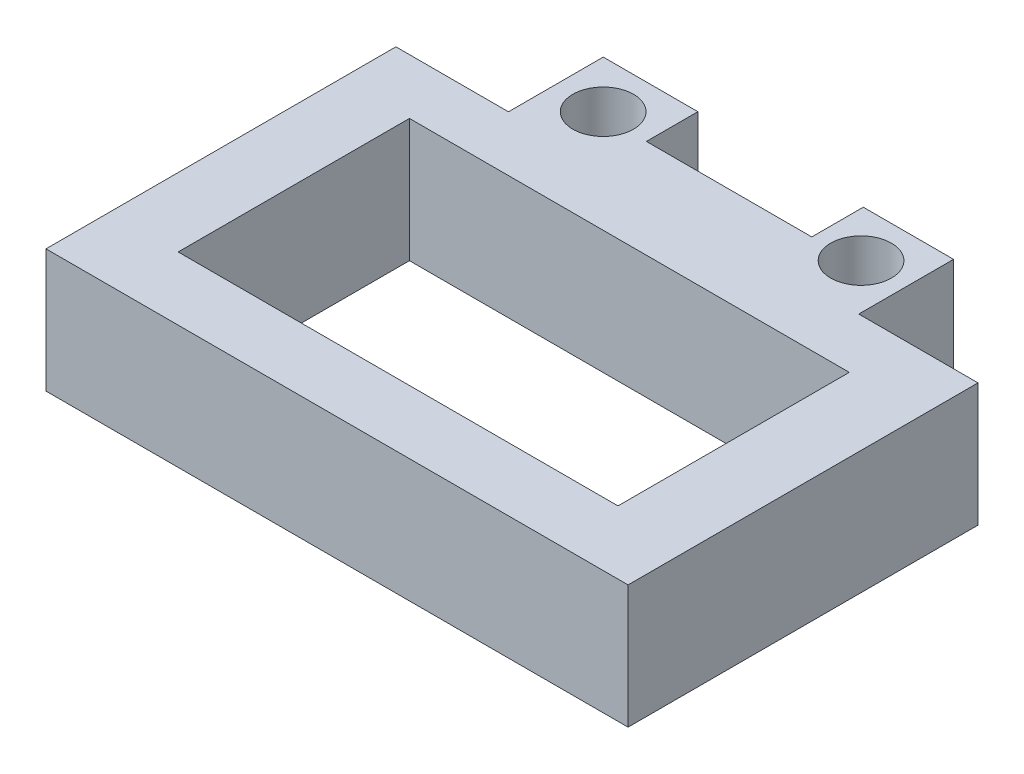
from build123d import *

# Parameters (mm, degrees)
SKETCH1_R           = 1.6
SKETCH1_W           = 30.70266837
SKETCH1_H           = 18.457088441
SKETCH1_W_2         = 23.2
SKETCH1_H_2         = 12.2
BOSS_EXTRUDE5_DEPTH = 6.5


with BuildPart() as part:
    # Sketch1 → Boss-Extrude5 (new body)
    # profile 1 of 2: a face of its own
    with BuildSketch(Plane(origin=(0, 0, 0), x_dir=(1, 0, 0), z_dir=(0, 1, 0))):
        Polygon((23.208363186, 35.61697891), (23.208363186, 32.900104101), (31.932950893, 32.900104101), (31.932950893, 35.61697891), (36.695280427, 35.61697891), (36.695280427, 30.61697891), (18.217441835, 30.61697891), (18.217441835, 35.61697891), align=None)
        with Locations(Location((20.712902511, 33.11697891, 0), (0, 0, 90))):
            Circle(SKETCH1_R, mode=Mode.SUBTRACT)
        with Locations(Location((34.31411566, 33.11697891, 0), (0, 0, 90))):
            Circle(SKETCH1_R, mode=Mode.SUBTRACT)
    # profile 2 of 2: a face of its own
    with BuildSketch(Plane(origin=(0, 0, 0), x_dir=(1, 0, 0), z_dir=(0, 1, 0))):
        with Locations((27.63237184, 21.38843469)):
            Rectangle(SKETCH1_W, SKETCH1_H)
        with Locations((27.508406256, 21.602944359)):
            Rectangle(SKETCH1_W_2, SKETCH1_H_2, mode=Mode.SUBTRACT)
    extrude(amount=BOSS_EXTRUDE5_DEPTH)


solid = part.part
